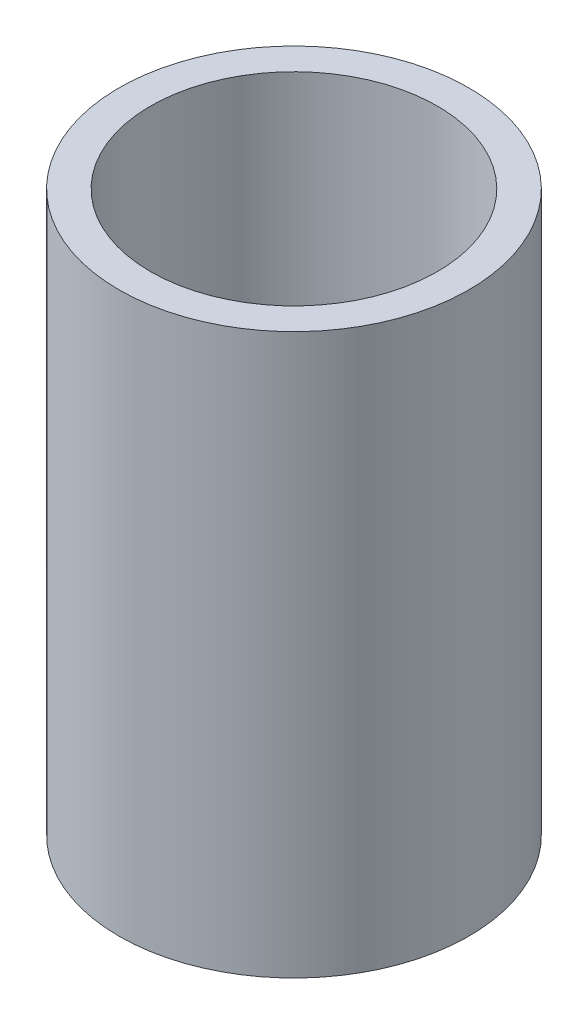
from build123d import *

# Parameters (mm, degrees)
SKETCH1_R           = 5
SKETCH1_R_2         = 4.1
BOSS_EXTRUDE1_DEPTH = 16


with BuildPart() as part:
    # Sketch1 → Boss-Extrude1 (new body)
    with BuildSketch(Plane(origin=(0, 0, 0), x_dir=(1, 0, 0), z_dir=(0, 1, 0))):
        with Locations(Location((0, 0, 0), (0, 0, 270))):
            Circle(SKETCH1_R)
        with Locations(Location((0, 0, 0), (0, 0, 270))):
            Circle(SKETCH1_R_2, mode=Mode.SUBTRACT)
    extrude(amount=BOSS_EXTRUDE1_DEPTH)


solid = part.part
